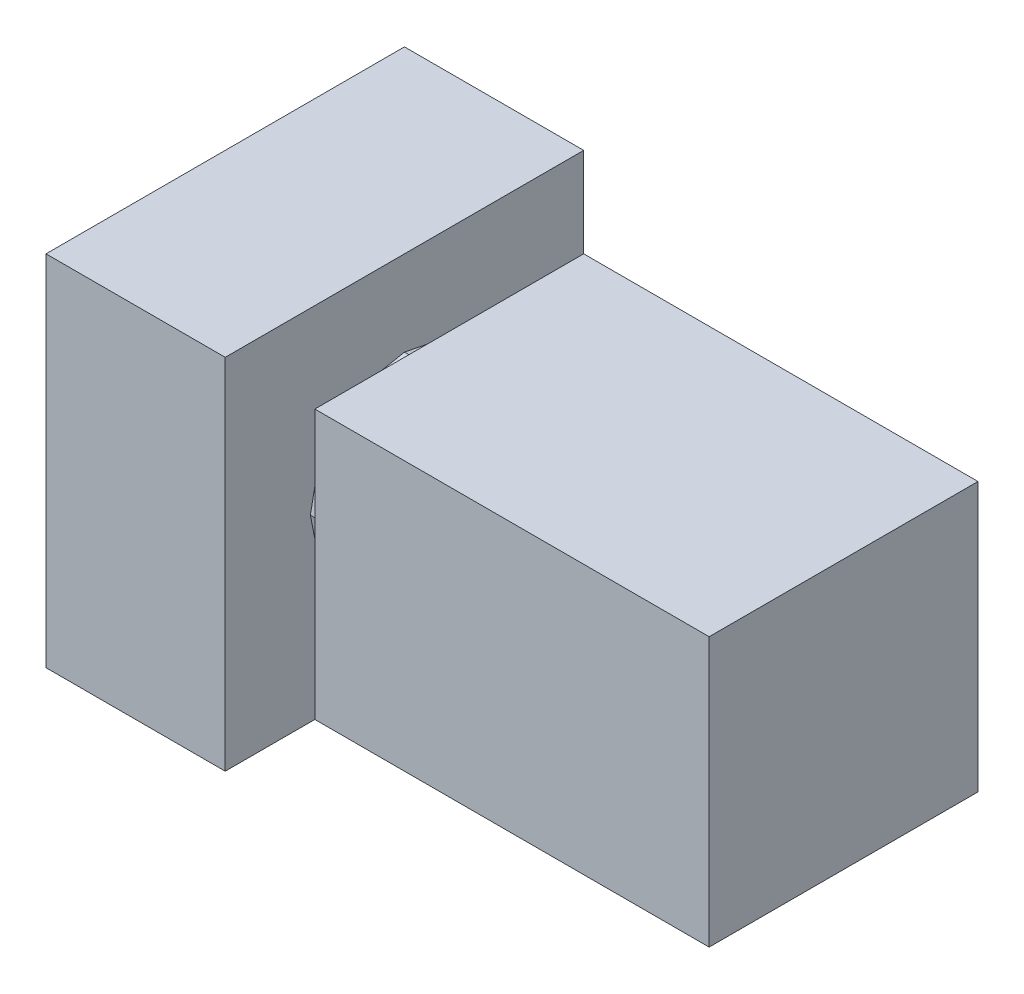
from build123d import *

# Parameters (mm, degrees)
SK_HEAD_W           = 20
SK_HEAD_H           = 40
HEAD_DEPTH          = 40
BUSHING_DEPTH       = 6
SK_CONTACT_BLOCK_W  = 44
SK_CONTACT_BLOCK_H  = 30
CONTACT_BLOCK_DEPTH = 30


with BuildPart() as part:
    # SK_Head → Head (new body)
    with BuildSketch(Plane.XY.offset(215)):
        with Locations((-84, 0)):
            Rectangle(SK_HEAD_W, SK_HEAD_H)
    extrude(amount=HEAD_DEPTH)

    # SK_Bushing → Bushing (add)
    with BuildSketch(Plane(origin=(-74.5, 0, 0), x_dir=(0, 0, -1), z_dir=(1, 0, 0))):
        Polygon((-239.01817604, 9.700735091), (-242.424621202, 7.424621202), (-244.700735091, 4.01817604), (-245.5, 0), (-244.700735091, -4.01817604), (-242.424621202, -7.424621202), (-239.01817604, -9.700735091), (-235, -10.5), (-230.98182396, -9.700735091), (-227.575378798, -7.424621202), (-225.299264909, -4.01817604), (-224.5, 0), (-225.299264909, 4.01817604), (-227.575378798, 7.424621202), (-230.98182396, 9.700735091), (-235, 10.5), align=None)
    extrude(amount=BUSHING_DEPTH)

    # SK_Contact_Block → Contact_Block (add)
    with BuildSketch(Plane.XY.offset(220)):
        with Locations((-47, 0)):
            Rectangle(SK_CONTACT_BLOCK_W, SK_CONTACT_BLOCK_H)
    extrude(amount=CONTACT_BLOCK_DEPTH)


solid = part.part
